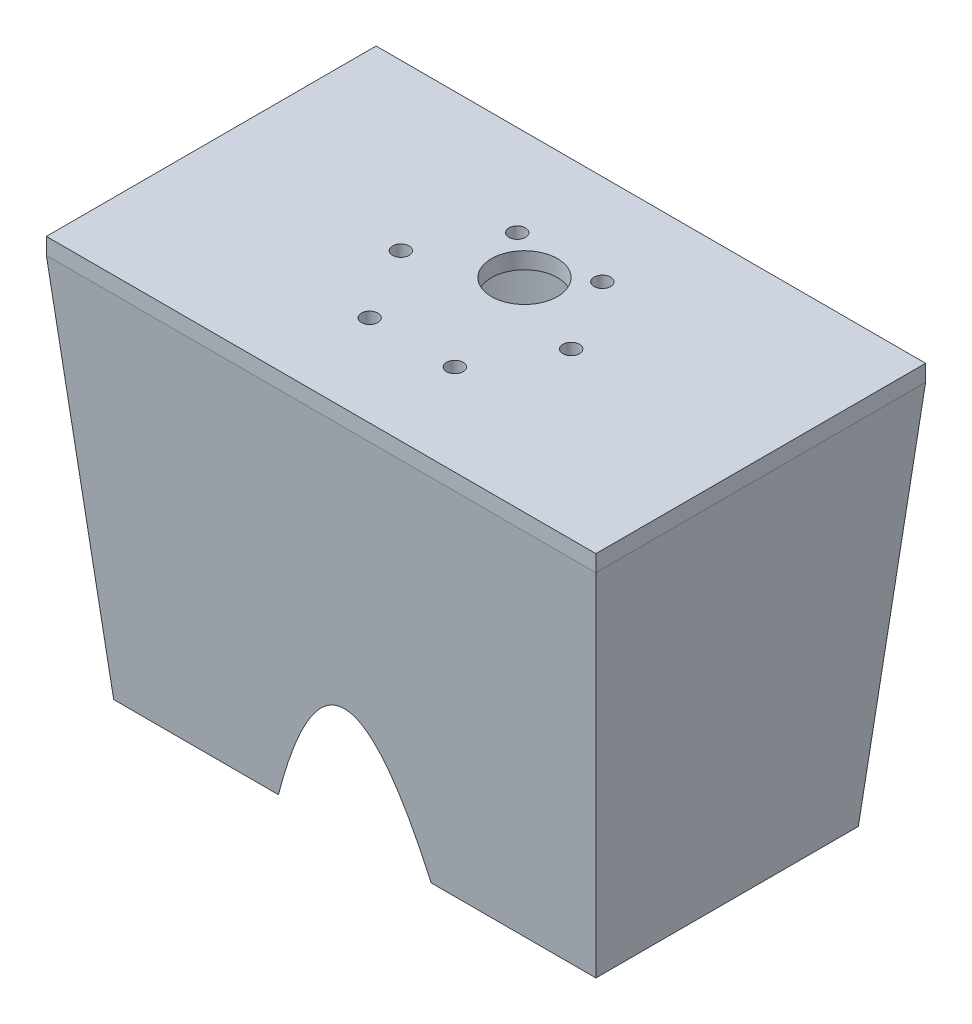
from build123d import *

# Parameters (mm, degrees)
CROQUIS1_W              = 100
CROQUIS1_H              = 60
CROQUIS1_R              = 6
CROQUIS1_R_2            = 1.5
SALIENTE_EXTRUIR1_DEPTH = 3
CROQUIS2_R              = 21.5
CROQUIS2_R_2            = 18.5
SALIENTE_EXTRUIR2_DEPTH = 20
CROQUIS4_W              = 100
CROQUIS4_H              = 60
CROQUIS4_R              = 21.5
SALIENTE_EXTRUIR3_DEPTH = 70
SALIENTE_EXTRUIR3_TAPER = 5


with BuildPart() as part:
    # Croquis1 → Saliente-Extruir1 (new body)
    with BuildSketch(Plane(origin=(0, 0, 0), x_dir=(1, 0, 0), z_dir=(0, 1, 0))):
        Rectangle(CROQUIS1_W, CROQUIS1_H)
        with Locations(Location((0, 7, 0), (0, 0, 270))):
            Circle(CROQUIS1_R, mode=Mode.SUBTRACT)
        with Locations(Location((15.5, 0, 0), (0, 0, 270))):
            Circle(CROQUIS1_R_2, mode=Mode.SUBTRACT)
        with Locations(Location((7.75, -13.423393759, 0), (0, 0, 270))):
            Circle(CROQUIS1_R_2, mode=Mode.SUBTRACT)
        with Locations(Location((-7.75, -13.423393759, 0), (0, 0, 270))):
            Circle(CROQUIS1_R_2, mode=Mode.SUBTRACT)
        with Locations(Location((-15.5, 0, 0), (0, 0, 270))):
            Circle(CROQUIS1_R_2, mode=Mode.SUBTRACT)
        with Locations(Location((-7.75, 13.423393759, 0), (0, 0, 270))):
            Circle(CROQUIS1_R_2, mode=Mode.SUBTRACT)
        with Locations(Location((7.75, 13.423393759, 0), (0, 0, 270))):
            Circle(CROQUIS1_R_2, mode=Mode.SUBTRACT)
    extrude(amount=SALIENTE_EXTRUIR1_DEPTH)

    # Croquis2 → Saliente-Extruir2 (add)
    with BuildSketch(Plane(origin=(0, 0, 0), x_dir=(1, 0, 0), z_dir=(0, 1, 0))):
        with Locations(Location((0, 0, 0), (0, 0, 270))):
            Circle(CROQUIS2_R)
        with Locations(Location((0, 0, 0), (0, 0, 270))):
            Circle(CROQUIS2_R_2, mode=Mode.SUBTRACT)
    extrude(amount=-SALIENTE_EXTRUIR2_DEPTH)

    # Croquis4 → Saliente-Extruir3 (add)
    with BuildSketch(Plane.XZ):
        Rectangle(CROQUIS4_W, CROQUIS4_H)
        with Locations(Location((0, 0, 0), (0, 0, 90))):
            Circle(CROQUIS4_R, mode=Mode.SUBTRACT)
    extrude(amount=SALIENTE_EXTRUIR3_DEPTH, taper=SALIENTE_EXTRUIR3_TAPER)


solid = part.part
